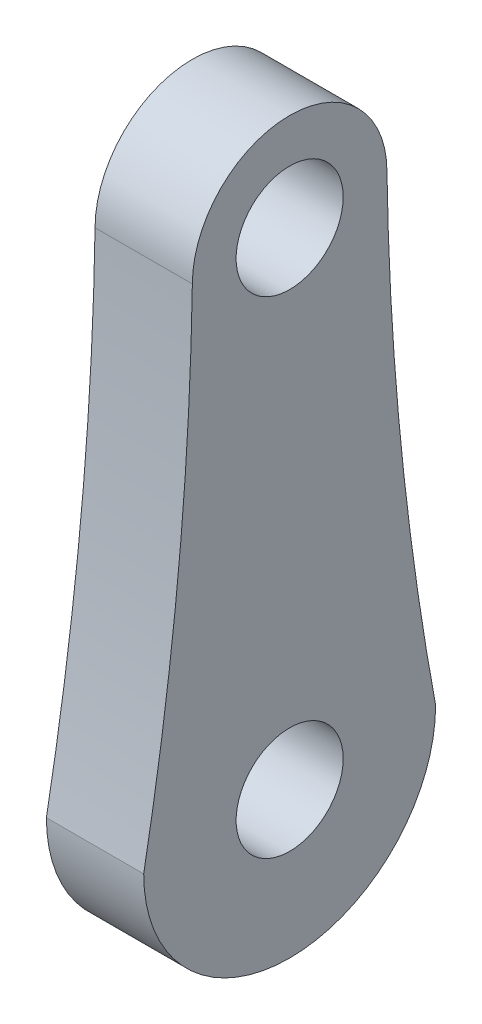
from build123d import *

# Parameters (mm, degrees)
SKETCH1_R                       = 10
BOSS_EXTRUDE1_DEPTH             = 10
M10_CLEARANCE_HOLE1_D           = 11
M10_CLEARANCE_HOLE1_ON_FACE_2_D = 11


with BuildPart() as part:
    # Sketch1 → Boss-Extrude1 (new body)
    with BuildSketch(Plane(origin=(0, 0, 0), x_dir=(0, 0, -1), z_dir=(1, 0, 0))):
        with BuildLine():
            ThreePointArc((-10, 50), (-11.202983752, 27.492262307), (-14.092449523, 5.138371963))
            ThreePointArc((-14.092449523, 5.138371963), (0, 15), (14.092449523, 5.138371963))
            ThreePointArc((14.092449523, 5.138371963), (11.202983752, 27.492262307), (10, 50))
            ThreePointArc((10, 50), (0, 40), (-10, 50))
        make_face()
        with Locations((0, 50)):
            Circle(SKETCH1_R)
        with BuildLine():
            ThreePointArc((-14.092449523, 5.138371963), (-14.535053081, 2.567212815), (-15, 0))
            ThreePointArc((-15, 0), (0, -15), (15, 0))
            ThreePointArc((15, 0), (14.535053081, 2.567212815), (14.092449523, 5.138371963))
            ThreePointArc((14.092449523, 5.138371963), (0, 15), (-14.092449523, 5.138371963))
        make_face()
    extrude(amount=BOSS_EXTRUDE1_DEPTH)

    # M10 Clearance Hole1 (through all)
    with Locations(Plane(origin=(10, 50, 0), x_dir=(0, 0, 1), z_dir=(1, 0, 0))):
        with Locations((0, 0), (0, 50)):
            Hole(M10_CLEARANCE_HOLE1_D / 2)

    # M10 Clearance Hole1 on face 2 (through all)
    with Locations(Plane(origin=(0, 0, 0), x_dir=(0, 0, -1), z_dir=(-1, 0, 0))):
        with Locations((0, 0)):
            Hole(M10_CLEARANCE_HOLE1_ON_FACE_2_D / 2)


solid = part.part
